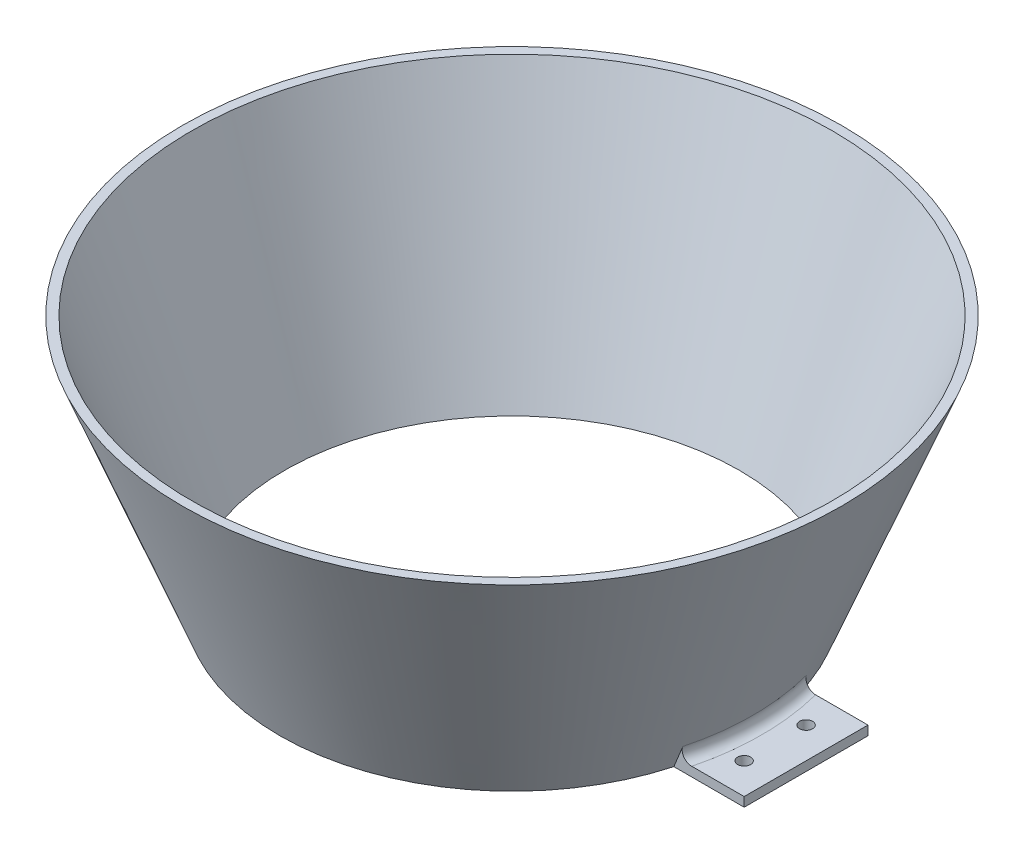
from build123d import *

# Parameters (mm, degrees)
BOSS_EXTRUDE1_DEPTH = 3
SKETCH3_R           = 2.1
CUT_EXTRUDE1_DEPTH  = 3
FILLET1_R           = 3


with BuildPart() as part:
    # Sketch1 → Revolve1 (revolve)
    with BuildSketch(Plane.XY, mode=Mode.PRIVATE) as revolve1_sk:
        Polygon((73.5, 0), (75, 0), (106.5, 80), (103.5, 80), align=None)
    revolve(revolve1_sk.sketch.rotate(Axis((0, 0, 0), (0, 1, 0)), 90), axis=Axis((0, 0, 0), (0, 1, 0)))

    # Sketch2 → Boss-Extrude1 (add)
    with BuildSketch(Plane.XZ):
        with BuildLine():
            Line((72.284161474, -20), (95, -20))
            Line((95, -20), (95, 20))
            Line((95, 20), (72.284161474, 20))
            ThreePointArc((72.284161474, 20), (75, 0), (72.284161474, -20))
        make_face()
        with BuildLine():
            Line((-95, 20), (-72.284161474, 20))
            ThreePointArc((-72.284161474, 20), (-75, 0), (-72.284161474, -20))
            Line((-72.284161474, -20), (-95, -20))
            Line((-95, -20), (-95, 20))
        make_face()
    extrude(amount=-BOSS_EXTRUDE1_DEPTH)

    # Sketch3 → Cut-Extrude1 (cut)
    with BuildSketch(Plane.XZ):
        with Locations(Location((85, 10, 0), (0, 0, 270))):
            Circle(SKETCH3_R)
        with Locations(Location((85, -10, 0), (0, 0, 90))):
            Circle(SKETCH3_R)
        with Locations(Location((-85, -10, 0), (0, 0, 270))):
            Circle(SKETCH3_R)
        with Locations(Location((-85, 10, 0), (0, 0, 90))):
            Circle(SKETCH3_R)
    extrude(amount=-CUT_EXTRUDE1_DEPTH, mode=Mode.SUBTRACT)

    # Fillet1
    fillet1_edges = [part.edges().sort_by_distance(p)[0] for p in [
        (76.18125, 3, 0),
        (-76.18125, 3, 0),
    ]]
    fillet(fillet1_edges, radius=FILLET1_R)


solid = part.part
